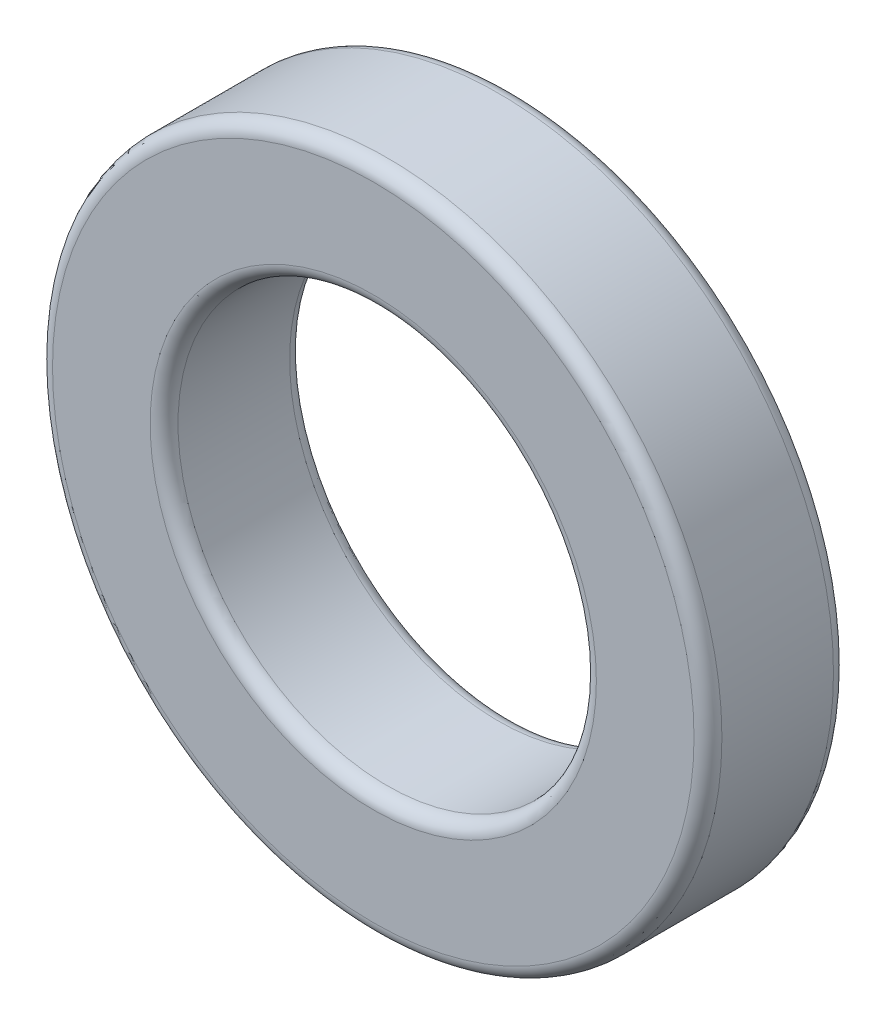
from build123d import *

# Parameters (mm, degrees)
SKETCH_1_R      = 12
SKETCH_1_R_2    = 7.5
EXTRUDE_1_DEPTH = 5
FILLET_1_R      = 0.5


with BuildPart() as part:
    # 草图1 → 凸台-拉伸1 (new body)
    with BuildSketch(Plane.XY):
        Circle(SKETCH_1_R)
        Circle(SKETCH_1_R_2, mode=Mode.SUBTRACT)
    extrude(amount=EXTRUDE_1_DEPTH)

    # 圆角1
    fillet_1_edges = [part.edges().sort_by_distance(p)[0] for p in [
        (-12, 0, 0),
        (-12, 0, 5),
        (-7.5, 0, 0),
        (-7.5, 0, 5),
    ]]
    fillet(fillet_1_edges, radius=FILLET_1_R)


solid = part.part
